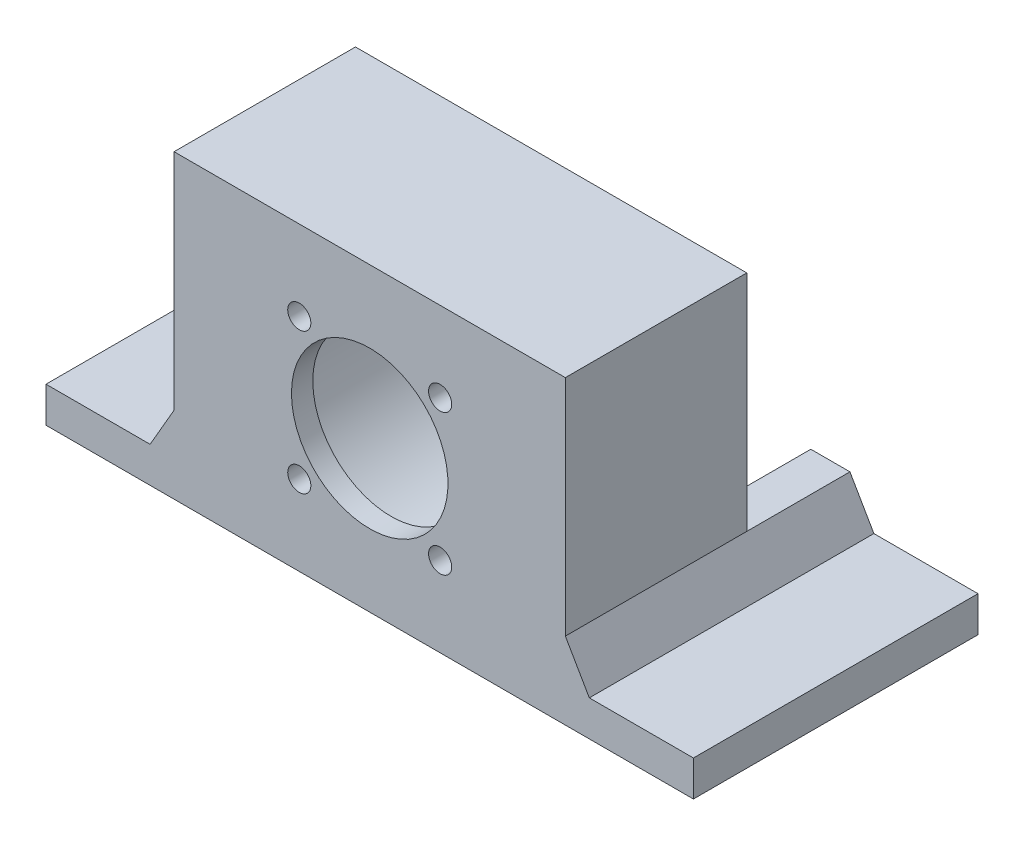
from build123d import *

# Parameters (mm, degrees)
ESQUISSE1_W                  = 55
ESQUISSE1_H                  = 42.3
BOSS_EXTRU_1_DEPTH           = 25.5
ESQUISSE4_R                  = 18.1
ENL_V_MAT_EXTRU_3_DEPTH      = 22.5
ENL_V_MAT_EXTRU_4_DEPTH      = 62.713369702
ENL_V_MAT_EXTRU_4_DEPTH_BACK = 62.713369702
ESQUISSE5_R                  = 11
ESQUISSE6_R                  = 1.625
ENL_V_MAT_EXTRU_5_DEPTH      = 10
BOSS_EXTRU_2_DEPTH           = 40
ESQUISSE16_W                 = 5.5
ESQUISSE16_H                 = 10.832527472
BOSS_EXTRU_4_DEPTH           = 14.5


with BuildPart() as part:
    # Esquisse1 → Boss.-Extru.1 (new body)
    with BuildSketch(Plane.XY):
        with Locations((27.5, 21.15)):
            Rectangle(ESQUISSE1_W, ESQUISSE1_H)
    extrude(amount=BOSS_EXTRU_1_DEPTH)

    # Esquisse4 → Enlèv. mat.-Extru.3 (cut)
    with BuildSketch(Plane.XY):
        with Locations(Location((27.5, 21.15, 0), (0, 0, 180))):
            Circle(ESQUISSE4_R)
    extrude(amount=ENL_V_MAT_EXTRU_3_DEPTH, mode=Mode.SUBTRACT)

    # Esquisse5 → Enlèv. mat.-Extru.4 (cut, two sides: drawn at the far end of the back side and taken through both)
    with BuildSketch(Plane(origin=(37, 0, 25.5), x_dir=(-1, 0, 0), z_dir=(0, 0, -1)).offset(-ENL_V_MAT_EXTRU_4_DEPTH_BACK)):
        with Locations((9.5, 21.15)):
            Circle(ESQUISSE5_R)
    extrude(amount=ENL_V_MAT_EXTRU_4_DEPTH + ENL_V_MAT_EXTRU_4_DEPTH_BACK, mode=Mode.SUBTRACT)

    # Esquisse6 → Enlèv. mat.-Extru.5 (cut)
    with BuildSketch(Plane(origin=(0, 0, 25.5), x_dir=(-1, 0, 0), z_dir=(0, 0, -1))):
        with Locations((-37.399494937, 31.049494937)):
            Circle(ESQUISSE6_R)
        with Locations((-17.600505063, 31.049494937)):
            Circle(ESQUISSE6_R)
        with Locations((-17.600505063, 11.250505063)):
            Circle(ESQUISSE6_R)
        with Locations((-37.399494937, 11.250505063)):
            Circle(ESQUISSE6_R)
    extrude(amount=ENL_V_MAT_EXTRU_5_DEPTH, mode=Mode.SUBTRACT)

    # Esquisse7 → Boss.-Extru.2 (add)
    with BuildSketch(Plane.XY.offset(25.5)):
        Polygon((55, 0), (73, 0), (73, 5), (58.367411306, 5), (55, 10.832527472), align=None)
        Polygon((-18, 0), (-18, 5), (-3.367411306, 5), (0, 10.832527472), (0, 0), align=None)
    extrude(amount=-BOSS_EXTRU_2_DEPTH)

    # Esquisse16 → Boss.-Extru.4 (add)
    with BuildSketch(Plane(origin=(0, 0, 0), x_dir=(-1, 0, 0), z_dir=(0, 0, -1))):
        with Locations((-2.75, 5.416263736)):
            Rectangle(ESQUISSE16_W, ESQUISSE16_H)
        with Locations((-52.25, 5.416263736)):
            Rectangle(ESQUISSE16_W, ESQUISSE16_H)
    extrude(amount=BOSS_EXTRU_4_DEPTH)


solid = part.part
